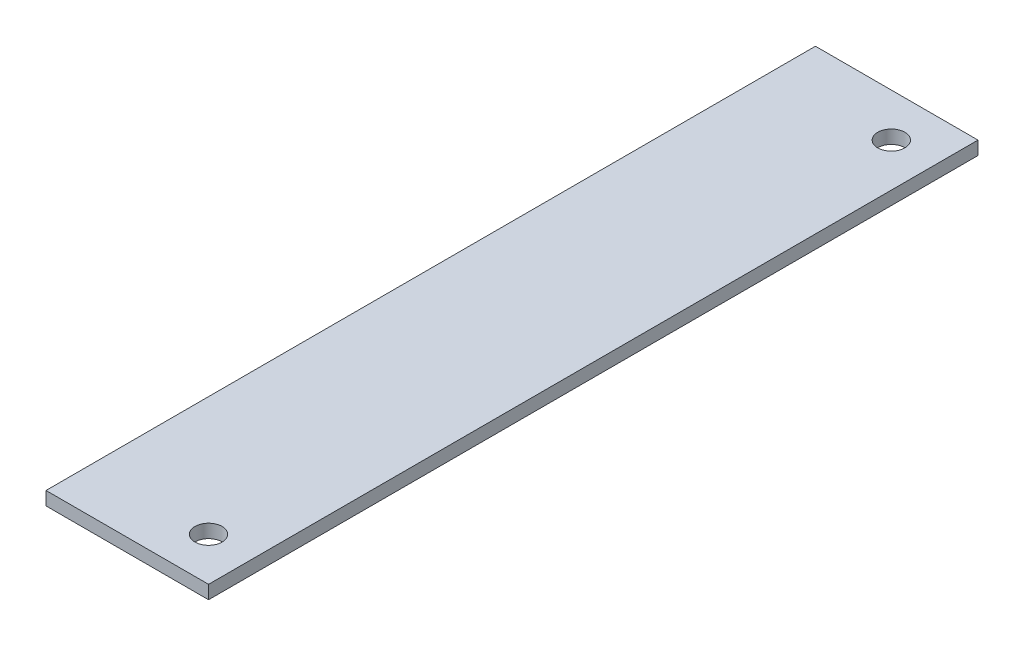
from build123d import *

# Parameters (mm, degrees)
SKETCH1_W           = 19.05
SKETCH1_H           = 90.17
BOSS_EXTRUDE1_DEPTH = 1.57
SKETCH2_R           = 1.59
CUT_EXTRUDE1_DEPTH  = 47.106916509


with BuildPart() as part:
    # Sketch1 → Boss-Extrude1 (new body)
    with BuildSketch(Plane(origin=(0, 0, 0), x_dir=(1, 0, 0), z_dir=(0, 1, 0))):
        Rectangle(SKETCH1_W, SKETCH1_H)
    extrude(amount=BOSS_EXTRUDE1_DEPTH)

    # Sketch2 → Cut-Extrude1 (cut, through all)
    with BuildSketch(Plane(origin=(0, 1.57, 0), x_dir=(1, 0, 0), z_dir=(0, 1, 0))):
        with Locations(Location((4.445, -40.005, 0), (0, 0, 270))):
            Circle(SKETCH2_R)
        with Locations(Location((4.445, 40.005, 0), (0, 0, 270))):
            Circle(SKETCH2_R)
    extrude(amount=-CUT_EXTRUDE1_DEPTH, mode=Mode.SUBTRACT)


solid = part.part
